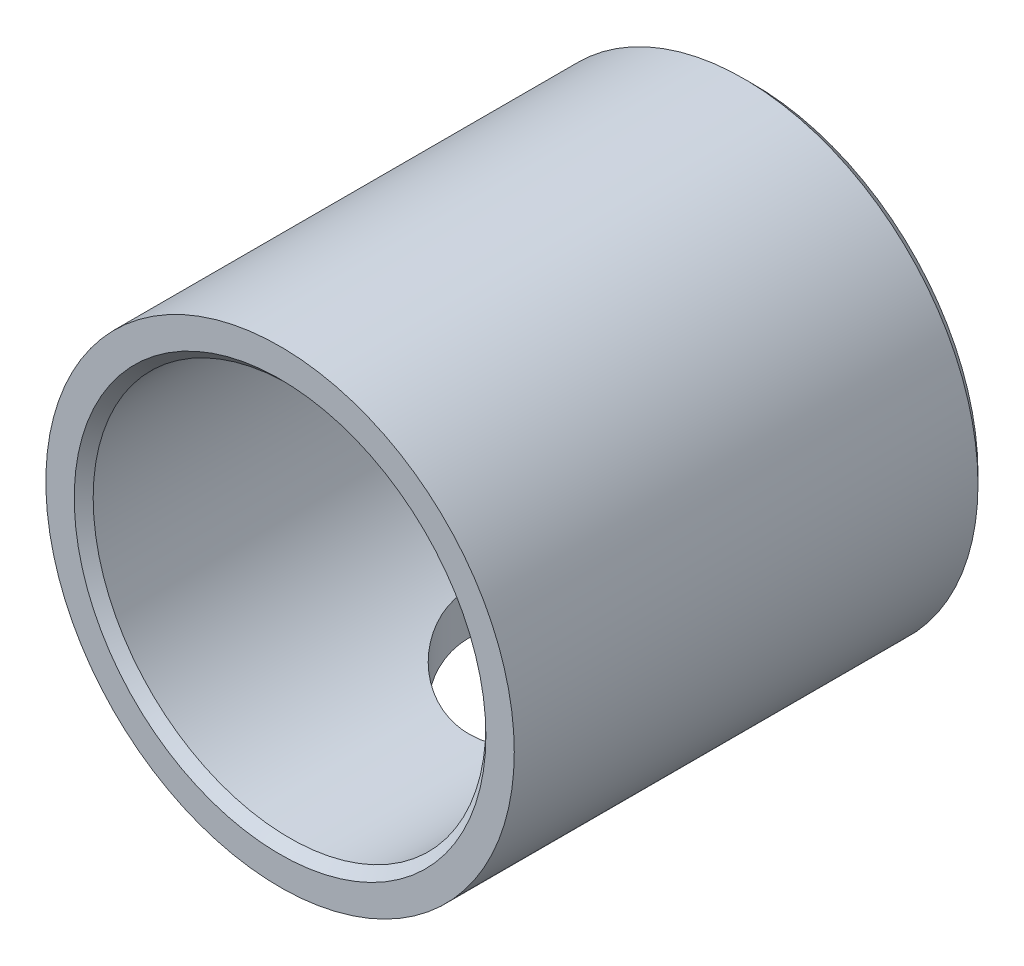
from build123d import *

# Parameters (mm, degrees)
SKETCH1_R           = 4.95
SKETCH1_R_2         = 4.15
BOSS_EXTRUDE1_DEPTH = 10
CHAMFER1_SIZE       = 0.2
SKETCH2_R           = 2.1
CUT_EXTRUDE1_DEPTH  = 13.206760422


with BuildPart() as part:
    # Sketch1 → Boss-Extrude1 (new body)
    with BuildSketch(Plane.XY):
        Circle(SKETCH1_R)
        Circle(SKETCH1_R_2, mode=Mode.SUBTRACT)
    extrude(amount=BOSS_EXTRUDE1_DEPTH)

    # Chamfer1
    chamfer1_edges = [part.edges().sort_by_distance(p)[0] for p in [
        (-4.95, 0, 0),
        (-4.15, 0, 0),
        (-4.15, 0, 10),
    ]]
    chamfer(chamfer1_edges, length=CHAMFER1_SIZE)

    # Sketch2 → Cut-Extrude1 (cut, through all)
    with BuildSketch(Plane(origin=(0, 0, 0), x_dir=(1, 0, 0), z_dir=(0, 1, 0))):
        with Locations(Location((0, -3.9, 0), (0, 0, 270))):
            Circle(SKETCH2_R)
    extrude(amount=-CUT_EXTRUDE1_DEPTH, mode=Mode.SUBTRACT)


solid = part.part
